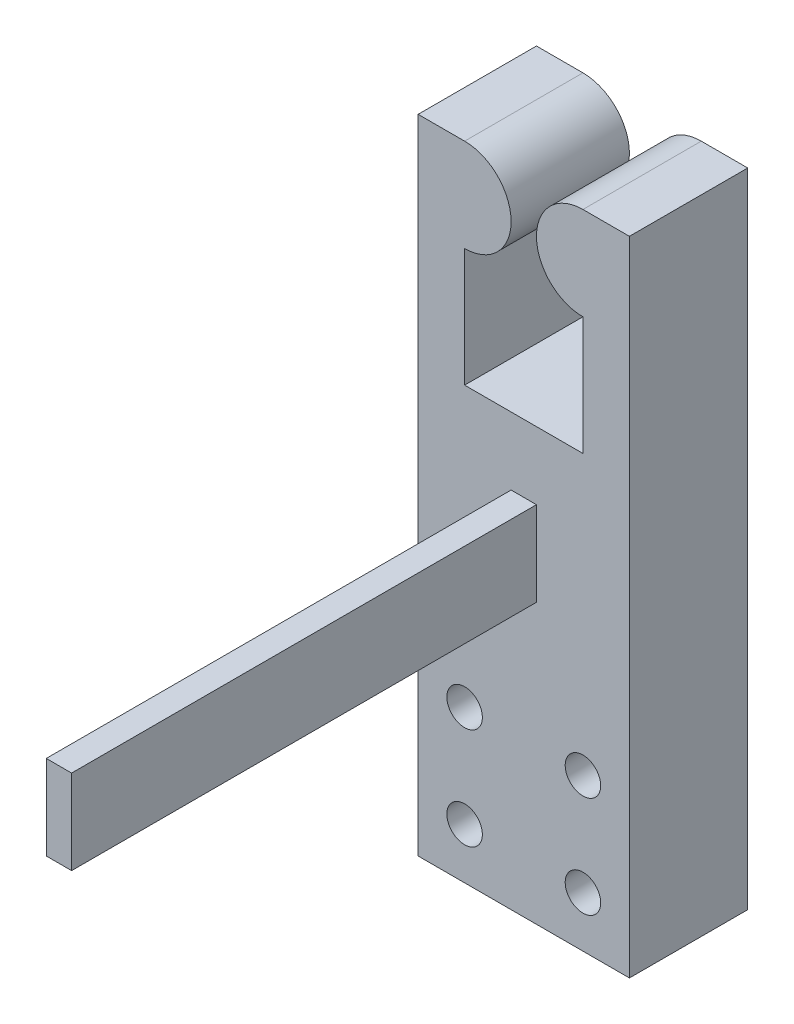
from build123d import *

# Parameters (mm, degrees)
SKETCH_1_W          = 25
SKETCH_1_H          = 76
EXTRUDE_1_DEPTH     = 14
SKETCH_2_W          = 3
SKETCH_2_H          = 10
EXTRUDE_2_DEPTH     = 55
SKETCH_3_R          = 2.1
CUT_EXTRUDE_1_DEPTH = 69.009190555
CUT_EXTRUDE_3_DEPTH = 69.009190555
SKETCH_6_R          = 3
CUT_EXTRUDE_4_DEPTH = 5


with BuildPart() as part:
    # 草图1 → 凸台-拉伸1 (new body)
    with BuildSketch(Plane.XY):
        Rectangle(SKETCH_1_W, SKETCH_1_H)
    extrude(amount=EXTRUDE_1_DEPTH)

    # 草图2 → 凸台-拉伸2 (add)
    with BuildSketch(Plane.XY.offset(14)):
        Rectangle(SKETCH_2_W, SKETCH_2_H)
    extrude(amount=EXTRUDE_2_DEPTH)

    # 草图3 → 切除-拉伸1 (cut, through all)
    with BuildSketch(Plane.XY.offset(14)):
        with Locations((-7, -20)):
            Circle(SKETCH_3_R)
        with Locations((-7, -32)):
            Circle(SKETCH_3_R)
        with Locations(Location((7, -32, 0), (0, 0, 180))):
            Circle(SKETCH_3_R)
        with Locations(Location((7, -20, 0), (0, 0, 180))):
            Circle(SKETCH_3_R)
    extrude(amount=-CUT_EXTRUDE_1_DEPTH, mode=Mode.SUBTRACT)

    # 草图5 → 切除-拉伸3 (cut, through all)
    with BuildSketch(Plane.XY.offset(14)):
        with BuildLine():
            Line((-7, 13), (7, 13))
            Line((7, 13), (7, 27))
            ThreePointArc((7, 27), (1.5, 32.5), (7, 38))
            Line((7, 38), (-7, 38))
            ThreePointArc((-7, 38), (-1.5, 32.5), (-7, 27))
            Line((-7, 27), (-7, 13))
        make_face()
    extrude(amount=-CUT_EXTRUDE_3_DEPTH, mode=Mode.SUBTRACT)

    # 草图6 → 切除-拉伸4 (cut)
    with BuildSketch(Plane(origin=(0, 0, 0), x_dir=(-1, 0, 0), z_dir=(0, 0, -1))):
        with Locations((7, -20)):
            Circle(SKETCH_6_R)
        with Locations((-7, -20)):
            Circle(SKETCH_6_R)
        with Locations((-7, -32)):
            Circle(SKETCH_6_R)
        with Locations((7, -32)):
            Circle(SKETCH_6_R)
    extrude(amount=-CUT_EXTRUDE_4_DEPTH, mode=Mode.SUBTRACT)


solid = part.part
